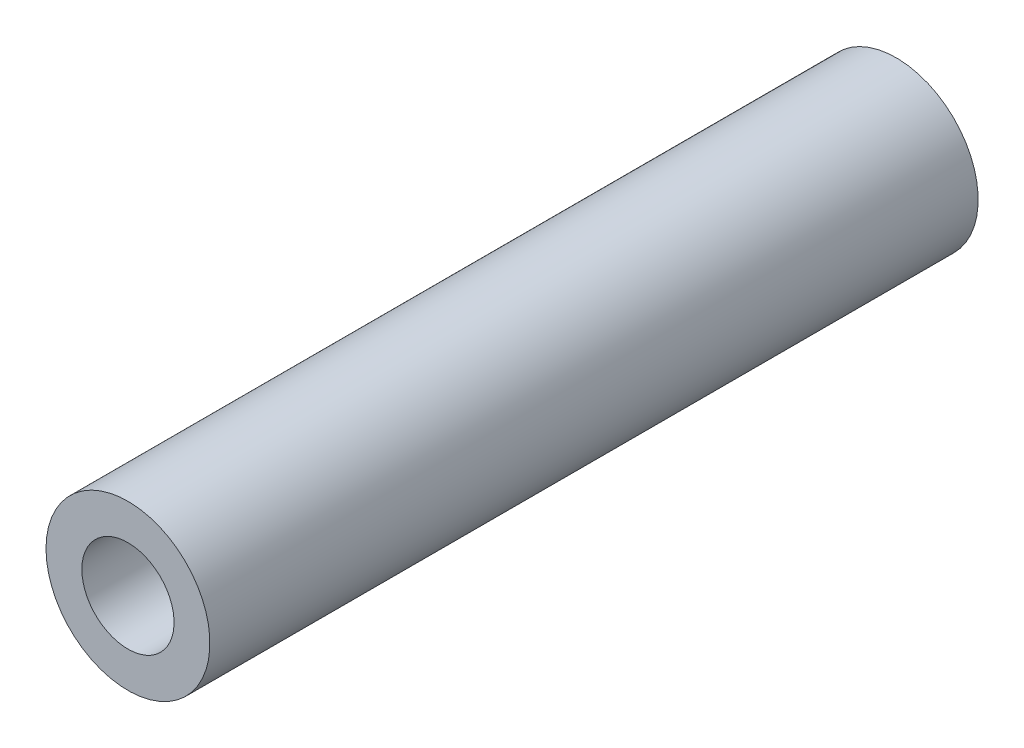
from build123d import *

# Parameters (mm, degrees)
SKETCH1_R           = 4.8
SKETCH1_R_2         = 2.7
BOSS_EXTRUDE1_DEPTH = 45


with BuildPart() as part:
    # Sketch1 → Boss-Extrude1 (new body)
    with BuildSketch(Plane.XY):
        with Locations(Location((0, 0, 0), (0, 0, 180))):
            Circle(SKETCH1_R)
        with Locations(Location((0, 0, 0), (0, 0, 180))):
            Circle(SKETCH1_R_2, mode=Mode.SUBTRACT)
    extrude(amount=BOSS_EXTRUDE1_DEPTH)


solid = part.part
